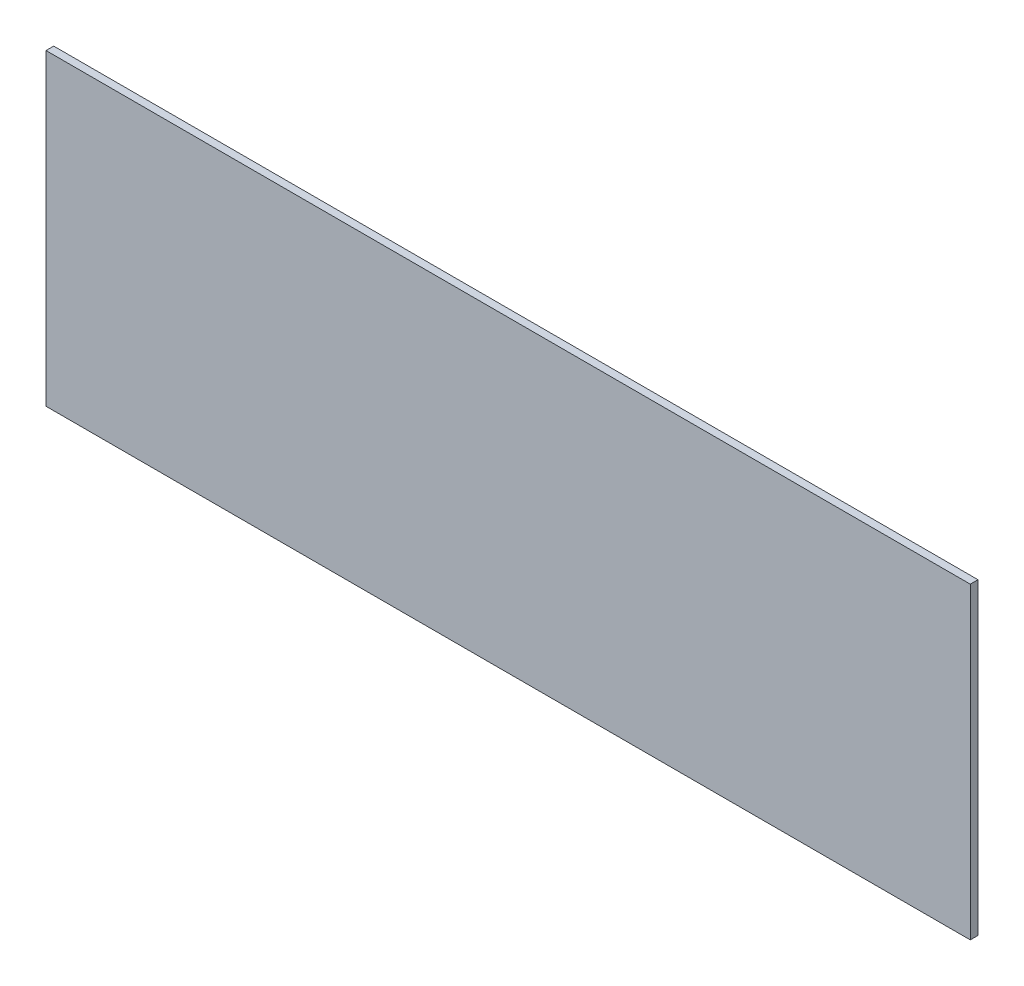
from build123d import *

# Parameters (mm, degrees)
SKETCH1_W      = 600
SKETCH1_H      = 200
EXTRUDE1_DEPTH = 5


with BuildPart() as part:
    # Sketch1 → Extrude1 (new body)
    with BuildSketch(Plane.XY):
        with Locations((0, 100)):
            Rectangle(SKETCH1_W, SKETCH1_H)
    extrude(amount=EXTRUDE1_DEPTH)


solid = part.part
